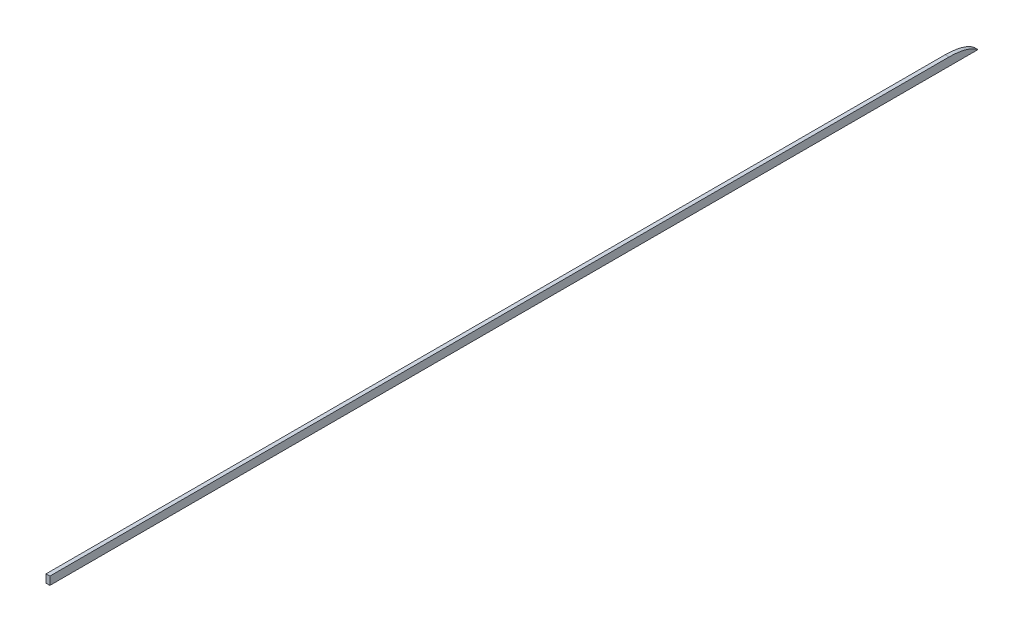
from build123d import *

# Parameters (mm, degrees)
BOSS_EXTRUDE1_DEPTH = 1.27


with BuildPart() as part:
    # Sketch1 → Boss-Extrude1 (new body)
    with BuildSketch(Plane(origin=(0, 0, 0), x_dir=(0, 0, -1), z_dir=(1, 0, 0))):
        with BuildLine():
            Line((0, 0), (304.8, 0))
            add(Edge.make_bspline(
                [(304.8, 0), (301.604734919, 2.56681203), (295.275, 2.667)],
                knots=[0, 0, 0, 1, 1, 1], degree=2))
            Line((295.275, 2.667), (0, 2.667))
            Line((0, 2.667), (0, 0))
        make_face()
    extrude(amount=BOSS_EXTRUDE1_DEPTH)


solid = part.part
